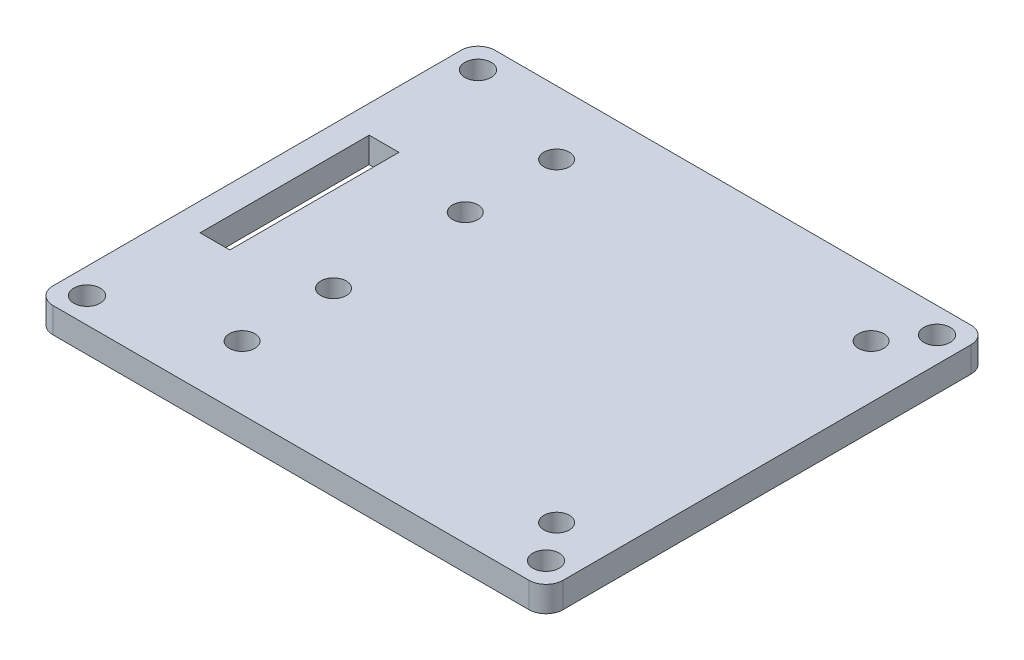
from build123d import *

# Parameters (mm, degrees)
SKETCH1_W           = 60
SKETCH1_H           = 52
SKETCH1_R           = 1.5
SKETCH1_R_2         = 1.55
SKETCH1_W_2         = 3.5
SKETCH1_H_2         = 19.9
BOSS_EXTRUDE1_DEPTH = 3
FILLET1_R           = 2


with BuildPart() as part:
    # Sketch1 → Boss-Extrude1 (new body)
    with BuildSketch(Plane(origin=(0, 0, 0), x_dir=(1, 0, 0), z_dir=(0, 1, 0))):
        with Locations((-5.25, 0)):
            Rectangle(SKETCH1_W, SKETCH1_H)
        with Locations(Location((-18.5, -18.5, 0), (0, 0, 270))):
            Circle(SKETCH1_R, mode=Mode.SUBTRACT)
        with Locations(Location((-18.5, 18.5, 0), (0, 0, 270))):
            Circle(SKETCH1_R, mode=Mode.SUBTRACT)
        with Locations(Location((18.5, 18.5, 0), (0, 0, 270))):
            Circle(SKETCH1_R, mode=Mode.SUBTRACT)
        with Locations(Location((18.5, -18.5, 0), (0, 0, 270))):
            Circle(SKETCH1_R, mode=Mode.SUBTRACT)
        with Locations(Location((-18.5, -7.75, 0), (0, 0, 270))):
            Circle(SKETCH1_R, mode=Mode.SUBTRACT)
        with Locations(Location((-18.5, 7.75, 0), (0, 0, 270))):
            Circle(SKETCH1_R, mode=Mode.SUBTRACT)
        with Locations(Location((-32.25, 23, 0), (0, 0, 270))):
            Circle(SKETCH1_R_2, mode=Mode.SUBTRACT)
        with Locations(Location((21.75, 23, 0), (0, 0, 270))):
            Circle(SKETCH1_R_2, mode=Mode.SUBTRACT)
        with Locations(Location((21.75, -23, 0), (0, 0, 270))):
            Circle(SKETCH1_R_2, mode=Mode.SUBTRACT)
        with Locations(Location((-32.25, -23, 0), (0, 0, 270))):
            Circle(SKETCH1_R_2, mode=Mode.SUBTRACT)
        with Locations((-30.25, 0)):
            Rectangle(SKETCH1_W_2, SKETCH1_H_2, mode=Mode.SUBTRACT)
    extrude(amount=BOSS_EXTRUDE1_DEPTH)

    # Fillet1
    fillet1_edges = [part.edges().sort_by_distance(p)[0] for p in [
        (-35.25, 1.5, -26),
        (24.75, 1.5, -26),
        (24.75, 1.5, 26),
        (-35.25, 1.5, 26),
    ]]
    fillet(fillet1_edges, radius=FILLET1_R)


solid = part.part
